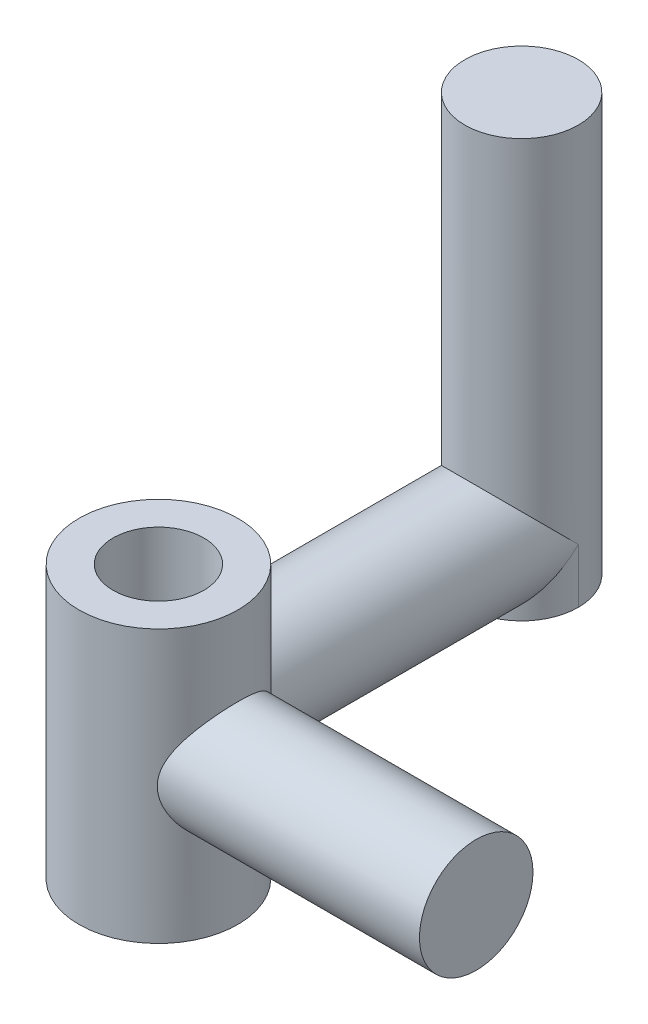
from build123d import *

# Parameters (mm, degrees)
SKETCH2_R           = 1.75
SKETCH2_R_2         = 1
BOSS_EXTRUDE1_DEPTH = 3
SKETCH3_R           = 1.25
BOSS_EXTRUDE2_DEPTH = 7
SKETCH4_R           = 1.25
BOSS_EXTRUDE3_DEPTH = 8
SKETCH5_R           = 1.25
BOSS_EXTRUDE4_DEPTH = 8
BOSS_EXTRUDE5_START = 1.2
SKETCH6_R           = 1.25
BOSS_EXTRUDE5_DEPTH = 1.2


with BuildPart() as part:
    # Sketch2 → Boss-Extrude1 (new, symmetric)
    with BuildSketch(Plane(origin=(0, 0, 0), x_dir=(1, 0, 0), z_dir=(0, 1, 0))):
        with Locations(Location((0, 0, 0), (0, 0, 270))):
            Circle(SKETCH2_R)
        with Locations(Location((0, 0, 0), (0, 0, 270))):
            Circle(SKETCH2_R_2, mode=Mode.SUBTRACT)
    extrude(amount=BOSS_EXTRUDE1_DEPTH, both=True)

    # Sketch3 → Boss-Extrude2 (add)
    with BuildSketch(Plane(origin=(0, 0, 0), x_dir=(0, 0, -1), z_dir=(1, 0, 0))):
        with Locations(Location((0, 0, 0), (0, 0, 180))):
            Circle(SKETCH3_R)
    extrude(amount=BOSS_EXTRUDE2_DEPTH)

    # Sketch4 → Boss-Extrude3 (add)
    with BuildSketch(Plane.XY):
        Circle(SKETCH4_R)
    extrude(amount=-BOSS_EXTRUDE3_DEPTH)

    # Sketch5 → Boss-Extrude4 (add)
    with BuildSketch(Plane(origin=(0, 0, 0), x_dir=(1, 0, 0), z_dir=(0, 1, 0))):
        with Locations((0, 8)):
            Circle(SKETCH5_R)
    extrude(amount=BOSS_EXTRUDE4_DEPTH)

    # Sketch6 → Boss-Extrude5 (add)
    with BuildSketch(Plane.XZ.offset(BOSS_EXTRUDE5_START)):
        with Locations((0, -8)):
            Circle(SKETCH6_R)
    extrude(amount=-BOSS_EXTRUDE5_DEPTH)


solid = part.part
